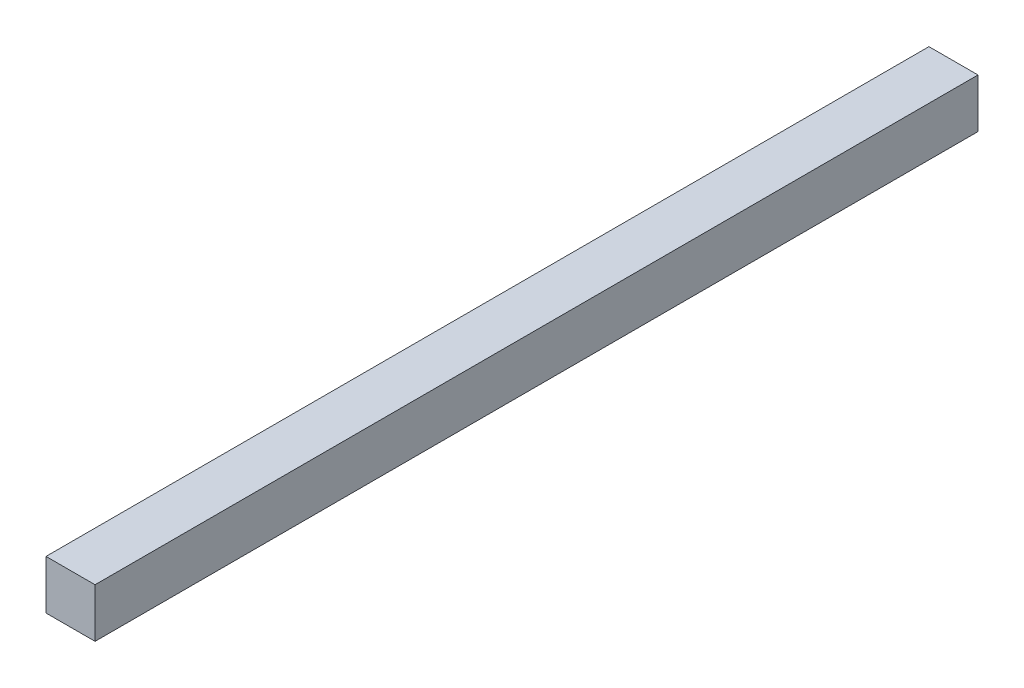
from build123d import *

# Parameters (mm, degrees)
SKETCH1_W           = 25.4
SKETCH1_H           = 25.4
BOSS_EXTRUDE1_DEPTH = 457.2


with BuildPart() as part:
    # Sketch1 → Boss-Extrude1 (new body)
    with BuildSketch(Plane.XY):
        with Locations((12.7, -12.7)):
            Rectangle(SKETCH1_W, SKETCH1_H)
    extrude(amount=BOSS_EXTRUDE1_DEPTH)


solid = part.part
